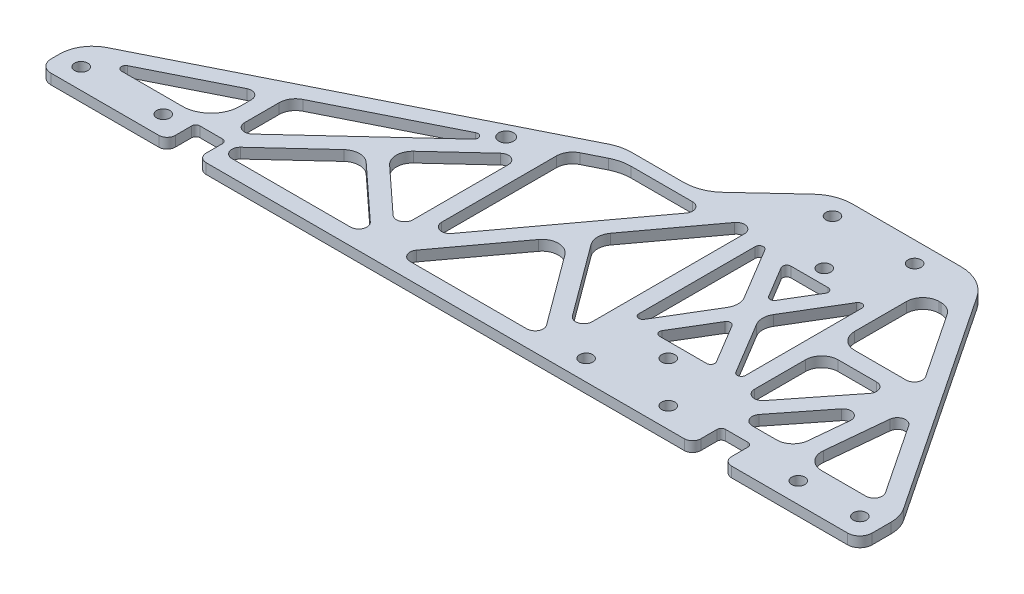
from build123d import *

# Parameters (mm, degrees)
SKETCH1_R               = 2.032
BOSS_EXTRUDE1_DEPTH     = 3.175
SKETCH1_3_R             = 2.032
CUT_EXTRUDE2_DEPTH      = 270.126904313
FILLET1_R               = 3.81
FILLET2_R               = 10.16
FILLET3_R               = 12.7
FILLET4_R               = 1.27
FILLET5_R               = 2.54
FILLET6_R               = 5.08
FILLET7_R               = 12.7
FILLET10_R              = 8.89
CUT_EXTRUDE5_DEPTH      = 270.126904313
CUT_EXTRUDE5_DEPTH_BACK = 270.126904313
FILLET11_R              = 12.7
SKETCH2_W               = 9.525
SKETCH2_H               = 8.89
CUT_EXTRUDE3_DEPTH      = 270.126904313
FILLET8_R               = 1.27
FILLET9_R               = 2.54
SKETCH3_R               = 2.286
CUT_EXTRUDE4_DEPTH      = 3.175


with BuildPart() as part:
    # Sketch1 → Boss-Extrude1 (new body)
    with BuildSketch(Plane(origin=(0, 0, 0), x_dir=(1, 0, 0), z_dir=(0, 1, 0))):
        Polygon((0, 0), (254, 0), (254, 12.7), (203.2, 88.9), (152.4, 88.9), (0, 12.7), align=None)
        with Locations(Location((6.773333333, 6.35, 0), (0, 0, 270))):
            Circle(SKETCH1_R, mode=Mode.SUBTRACT)
        with Locations(Location((32.173333333, 6.35, 0), (0, 0, 270))):
            Circle(SKETCH1_R, mode=Mode.SUBTRACT)
        with Locations(Location((228.6, 6.35, 0), (0, 0, 270))):
            Circle(SKETCH1_R, mode=Mode.SUBTRACT)
        with Locations(Location((247.65, 6.35, 0), (0, 0, 270))):
            Circle(SKETCH1_R, mode=Mode.SUBTRACT)
        with Locations(Location((162.983333333, 82.55, 0), (0, 0, 270))):
            Circle(SKETCH1_R, mode=Mode.SUBTRACT)
        with Locations(Location((188.383333333, 82.55, 0), (0, 0, 270))):
            Circle(SKETCH1_R, mode=Mode.SUBTRACT)
    extrude(amount=BOSS_EXTRUDE1_DEPTH)

    # Sketch1<3> → Cut-Extrude2 (cut, through all)
    with BuildSketch(Plane(origin=(0, 0, 0), x_dir=(1, 0, 0), z_dir=(0, 1, 0))):
        Polygon((8.819225326, 11.43), (41.91, 11.43), (41.91, 27.975387337), align=None)
        Polygon((73.025, 27.993892654), (48.195281614, 5.08), (97.854718386, 5.08), align=None)
        Polygon((46.99, 30.515387337), (46.99, 10.88031823), (93.426011301, 53.733392988), align=None)
        with Locations(Location((188.383333333, 6.35, 0), (0, 0, 270))):
            Circle(SKETCH1_3_R)
        Polygon((104.756949825, 5.08), (150.936383508, 5.08), (127.846666667, 36.362842172), align=None)
        with Locations(Location((162.983333333, 6.35, 0), (0, 0, 270))):
            Circle(SKETCH1_3_R)
        Polygon((99.06, 52.020069107), (76.770281614, 31.450193669), (99.06, 10.88031823), align=None)
        Polygon((142.499954937, 64.77), (115.499225326, 64.77), (104.14, 59.090387337), (104.14, 12.79844815), align=None)
        Polygon((223.00729992, 50.03094988), (205.561266507, 76.2), (197.273333333, 76.2), (197.273333333, 50.03094988), align=None)
        Polygon((131.003616492, 40.64), (154.093333333, 9.357157828), (154.093333333, 71.922842172), align=None)
        Polygon((197.273333333, 44.95094988), (197.273333333, 16.802739743), (219.463857142, 44.95094988), align=None)
        Polygon((166.148656896, 23.622), (185.218009771, 23.622), (175.683333333, 39.513127396), align=None)
        Polygon((178.645456896, 44.45), (192.193333333, 21.870205938), (192.193333333, 67.029794062), align=None)
        Polygon((221.333484531, 39.117053196), (201.508910253, 13.97), (218.885586813, 13.97), align=None)
        Polygon((223.865972381, 12.7), (247.89459984, 12.7), (226.927485283, 44.150671836), align=None)
        Polygon((159.173333333, 67.029794062), (159.173333333, 21.870205938), (172.721209771, 44.45), align=None)
        Polygon((175.683333333, 49.386872604), (183.694009771, 62.738), (167.672656896, 62.738), align=None)
        with Locations(Location((175.683333333, 19.05, 0), (0, 0, 270))):
            Circle(SKETCH1_3_R)
        with Locations(Location((175.683333333, 67.31, 0), (0, 0, 270))):
            Circle(SKETCH1_3_R)
    extrude(amount=CUT_EXTRUDE2_DEPTH, mode=Mode.SUBTRACT)

    # Fillet1
    fillet1_edges = [part.edges().sort_by_distance(p)[0] for p in [
        (0, 1.5875, 0),
        (254, 1.5875, 0),
    ]]
    fillet(fillet1_edges, radius=FILLET1_R)

    # Fillet2
    fillet2_edges = [part.edges().sort_by_distance(p)[0] for p in [
        (254, 1.5875, -12.7),
        (0, 1.5875, -12.7),
    ]]
    fillet(fillet2_edges, radius=FILLET2_R)

    # Fillet3
    fillet3_edges = [part.edges().sort_by_distance(p)[0] for p in [
        (203.2, 1.5875, -88.9),
        (152.4, 1.5875, -88.9),
    ]]
    fillet(fillet3_edges, radius=FILLET3_R)

    # Fillet4
    fillet4_edges = [part.edges().sort_by_distance(p)[0] for p in [
        (175.683333333, 1.5875, -39.513127396),
        (166.148656896, 1.5875, -23.622),
        (185.218009771, 1.5875, -23.622),
        (159.173333333, 1.5875, -67.029794062),
        (159.173333333, 1.5875, -21.870205938),
        (183.694009771, 1.5875, -62.738),
        (167.672656896, 1.5875, -62.738),
        (175.683333333, 1.5875, -49.386872604),
        (8.819225326, 1.5875, -11.43),
        (192.193333333, 1.5875, -67.029794062),
        (192.193333333, 1.5875, -21.870205938),
        (93.426011301, 1.5875, -53.733392988),
    ]]
    fillet(fillet4_edges, radius=FILLET4_R)

    # Fillet5
    fillet5_edges = [part.edges().sort_by_distance(p)[0] for p in [
        (247.89459984, 1.5875, -12.7),
        (226.927485283, 1.5875, -44.150671836),
        (221.333484531, 1.5875, -39.117053196),
        (201.508910253, 1.5875, -13.97),
        (41.91, 1.5875, -27.975387337),
        (99.06, 1.5875, -52.020069107),
        (99.06, 1.5875, -10.88031823),
        (97.854718386, 1.5875, -5.08),
        (48.195281614, 1.5875, -5.08),
        (150.936383508, 1.5875, -5.08),
        (104.756949825, 1.5875, -5.08),
        (142.499954937, 1.5875, -64.77),
        (104.14, 1.5875, -12.79844815),
        (223.00729992, 1.5875, -50.03094988),
        (197.273333333, 1.5875, -16.802739743),
        (219.463857142, 1.5875, -44.95094988),
        (154.093333333, 1.5875, -9.357157828),
        (154.093333333, 1.5875, -71.922842172),
        (46.99, 1.5875, -10.88031823),
    ]]
    fillet(fillet5_edges, radius=FILLET5_R)

    # Fillet6
    fillet6_edges = [part.edges().sort_by_distance(p)[0] for p in [
        (223.865972381, 1.5875, -12.7),
        (172.721209771, 1.5875, -44.45),
        (218.885586813, 1.5875, -13.97),
        (76.770281614, 1.5875, -31.450193669),
        (73.025, 1.5875, -27.993892654),
        (127.846666667, 1.5875, -36.362842172),
        (104.14, 1.5875, -59.090387337),
        (178.645456896, 1.5875, -44.45),
        (197.273333333, 1.5875, -50.03094988),
        (205.561266507, 1.5875, -76.2),
        (197.273333333, 1.5875, -76.2),
        (197.273333333, 1.5875, -44.95094988),
        (131.003616492, 1.5875, -40.64),
        (46.99, 1.5875, -30.515387337),
    ]]
    fillet(fillet6_edges, radius=FILLET6_R)

    # Fillet7
    fillet7_edges = [part.edges().sort_by_distance(p)[0] for p in [
        (115.499225326, 1.5875, -64.77),
    ]]
    fillet(fillet7_edges, radius=FILLET7_R)

    # Fillet10
    fillet10_edges = [part.edges().sort_by_distance(p)[0] for p in [
        (41.91, 1.5875, -11.43),
    ]]
    fillet(fillet10_edges, radius=FILLET10_R)

    # Sketch4 → Cut-Extrude5 (cut, two sides: drawn at the far end of the back side and taken through both)
    with BuildSketch(Plane(origin=(0, 3.175, 0), x_dir=(1, 0, 0), z_dir=(0, 1, 0)).offset(-CUT_EXTRUDE5_DEPTH_BACK)):
        with BuildLine():
            Line((111.76, 68.58), (118.49728864, 68.58))
            Line((118.49728864, 68.58), (135.969082876, 68.58))
            Line((135.969082876, 68.58), (157.79217598, 88.9))
            Line((157.79217598, 88.9), (155.398063314, 88.9))
            ThreePointArc((155.398063314, 88.9), (152.480201223, 88.560262166), (149.718450651, 87.559225326))
            Line((149.718450651, 87.559225326), (111.76, 68.58))
        make_face()
    extrude(amount=CUT_EXTRUDE5_DEPTH + CUT_EXTRUDE5_DEPTH_BACK, mode=Mode.SUBTRACT)

    # Fillet11
    fillet11_edges = [part.edges().sort_by_distance(p)[0] for p in [
        (157.79217598, 1.5875, -88.9),
        (135.969082876, 1.5875, -68.58),
        (111.76, 1.5875, -68.58),
    ]]
    fillet(fillet11_edges, radius=FILLET11_R)

    # Sketch2 → Cut-Extrude3 (cut, through all)
    with BuildSketch(Plane(origin=(0, 3.175, 0), x_dir=(1, 0, 0), z_dir=(0, 1, 0))):
        with Locations((44.45, 4.445)):
            Rectangle(SKETCH2_W, SKETCH2_H)
        with Locations((207.01, 4.445)):
            Rectangle(SKETCH2_W, SKETCH2_H)
    extrude(amount=-CUT_EXTRUDE3_DEPTH, mode=Mode.SUBTRACT)

    # Fillet8
    fillet8_edges = [part.edges().sort_by_distance(p)[0] for p in [
        (39.6875, 1.5875, -8.89),
        (49.2125, 1.5875, -8.89),
        (202.2475, 1.5875, -8.89),
        (211.7725, 1.5875, -8.89),
    ]]
    fillet(fillet8_edges, radius=FILLET8_R)

    # Fillet9
    fillet9_edges = [part.edges().sort_by_distance(p)[0] for p in [
        (39.6875, 1.5875, 0),
        (49.2125, 1.5875, 0),
        (202.2475, 1.5875, 0),
        (211.7725, 1.5875, 0),
    ]]
    fillet(fillet9_edges, radius=FILLET9_R)

    # Sketch3 → Cut-Extrude4 (cut)
    with BuildSketch(Plane(origin=(0, 3.175, 0), x_dir=(1, 0, 0), z_dir=(0, 1, 0))):
        with Locations(Location((91.288247909, 53.284636108, 0), (0, 0, 270))):
            Circle(SKETCH3_R)
    extrude(amount=-CUT_EXTRUDE4_DEPTH, mode=Mode.SUBTRACT)


solid = part.part
